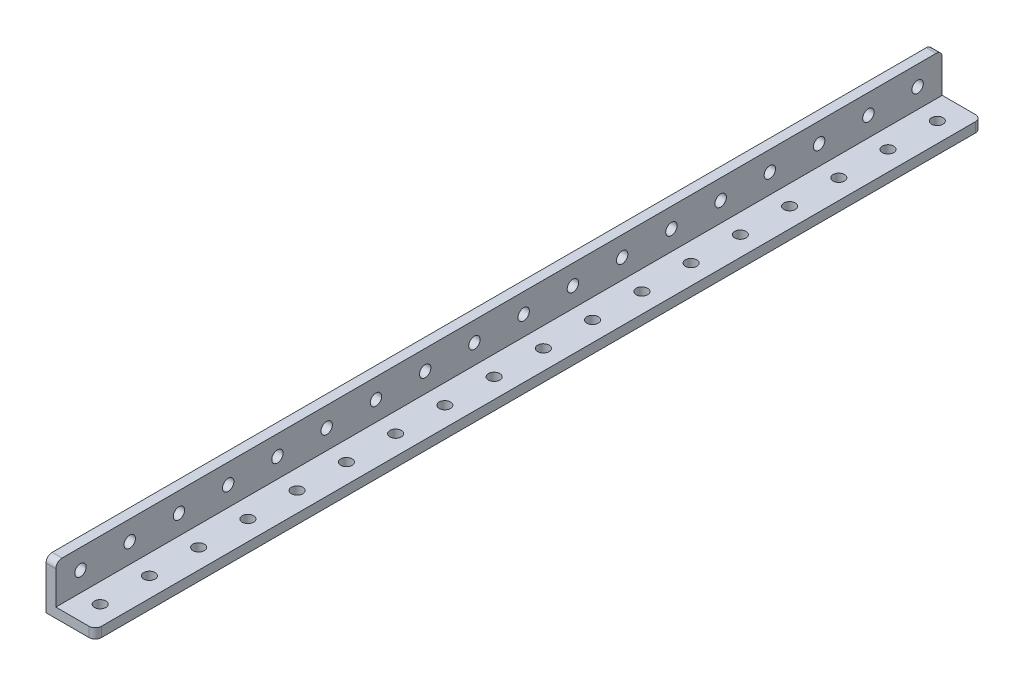
from build123d import *

# Parameters (mm, degrees)
SKETCH1_W                      = 16
SKETCH1_H                      = 288
BOSS_EXTRUDE1_DEPTH            = 16
SKETCH2_W                      = 12.8
SKETCH2_H                      = 12.8
CUT_EXTRUDE1_DEPTH             = 289.887521364
F_3_7_3_7_DIAMETER_HOLE1_D     = 3.7
F_3_7_3_7_DIAMETER_HOLE1_DEPTH = 16
F_3_7_3_7_DIAMETER_HOLE2_D     = 3.7
F_3_7_3_7_DIAMETER_HOLE2_DEPTH = 16
FILLET1_R                      = 2


with BuildPart() as part:
    # Sketch1 → Boss-Extrude1 (new body)
    with BuildSketch(Plane(origin=(0, 16, 0), x_dir=(1, 0, 0), z_dir=(0, 1, 0))):
        with Locations((8, 144)):
            Rectangle(SKETCH1_W, SKETCH1_H)
    extrude(amount=-BOSS_EXTRUDE1_DEPTH)

    # Sketch2 → Cut-Extrude1 (cut, through all)
    with BuildSketch(Plane(origin=(0, 0, -288), x_dir=(-1, 0, 0), z_dir=(0, 0, -1))):
        with Locations((-9.6, 9.6)):
            Rectangle(SKETCH2_W, SKETCH2_H)
    extrude(amount=-CUT_EXTRUDE1_DEPTH, mode=Mode.SUBTRACT)

    # Ø3.7 (3.7) Diameter Hole1
    with Locations(Plane(origin=(0, 0, 0), x_dir=(-1, 0, 0), z_dir=(0, -1, 0))):
        with Locations((-9.6, 24), (-9.6, 40), (-9.6, 56), (-9.6, 72), (-9.6, 88), (-9.6, 104), (-9.6, 120), (-9.6, 136), (-9.6, 152), (-9.6, 168), (-9.6, 184), (-9.6, 200), (-9.6, 216), (-9.6, 232), (-9.6, 248), (-9.6, 264), (-9.6, 280), (-9.6, 8)):
            Hole(F_3_7_3_7_DIAMETER_HOLE1_D / 2, depth=F_3_7_3_7_DIAMETER_HOLE1_DEPTH)

    # Ø3.7 (3.7) Diameter Hole2
    with Locations(Plane.ZY):
        with Locations((-24, 9.6), (-40, 9.6), (-56, 9.6), (-72, 9.6), (-88, 9.6), (-104, 9.6), (-120, 9.6), (-136, 9.6), (-152, 9.6), (-168, 9.6), (-184, 9.6), (-200, 9.6), (-216, 9.6), (-232, 9.6), (-248, 9.6), (-264, 9.6), (-280, 9.6), (-8, 9.6)):
            Hole(F_3_7_3_7_DIAMETER_HOLE2_D / 2, depth=F_3_7_3_7_DIAMETER_HOLE2_DEPTH)

    # Fillet1
    fillet1_edges = [part.edges().sort_by_distance(p)[0] for p in [
        (1.6, 16, -288),
        (1.6, 16, 0),
        (16, 1.6, -288),
        (16, 1.6, 0),
    ]]
    fillet(fillet1_edges, radius=FILLET1_R)


solid = part.part
